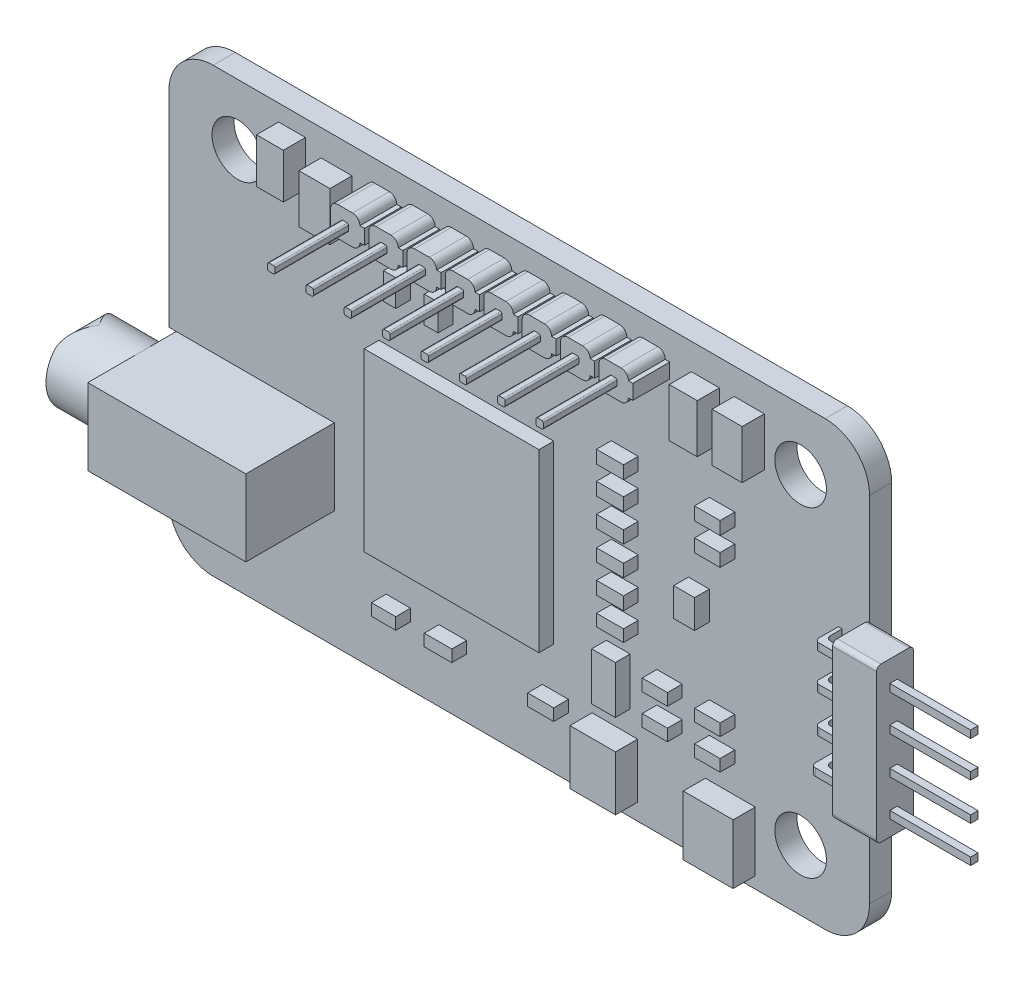
from build123d import *

# Parameters (mm, degrees)
SALIENTE_EXTRUIR1_DEPTH   = 1.5
CROQUIS3_R                = 1.75
CORTAR_EXTRUIR1_DEPTH     = 3
SIMETR_A2_COPY_1_SKETCH_R = 1.75
SIMETR_A2_COPY_1_DEPTH    = 3
CROQUIS4_W                = 11.845226559
CROQUIS4_H                = 11.924194736
SALIENTE_EXTRUIR2_DEPTH   = 1
SALIENTE_EXTRUIR3_DEPTH   = 2.5
SALIENTE_EXTRUIR4_DEPTH   = 5
MATRIZL1_COUNT            = 8
MATRIZL1_PITCH            = 2.6
CROQUIS8_W                = 1.5
CROQUIS8_H                = 5.17065222
SALIENTE_EXTRUIR6_DEPTH   = 3.5
REDONDEO1_R               = 1
SALIENTE_EXTRUIR9_DEPTH   = 2.5
CROQUIS16_W               = 5.476213479
CROQUIS16_H               = 0.902663256
CROQUIS16_H_2             = 1.097336744
CORTAR_EXTRUIR5_DEPTH     = 39.817275584
CROQUIS17_W               = 2.348739744
CROQUIS17_H               = 0.877282124
CORTAR_EXTRUIR6_DEPTH     = 39.817275584
REDONDEO3_R               = 0.3
REDONDEO4_R               = 0.3
CROQUIS18_W               = 2.038363461
CROQUIS18_H               = 3.297382371
CROQUIS18_W_2             = 1.896357523
CROQUIS18_W_3             = 2.098475258
CROQUIS18_W_4             = 1.819560696
CROQUIS18_H_2             = 3.043464634
CROQUIS18_W_5             = 3.09164171
CROQUIS18_H_3             = 3.700825875
CROQUIS18_W_6             = 3.382058764
CROQUIS18_H_4             = 4.039758247
SALIENTE_EXTRUIR10_DEPTH  = 1.5
CROQUIS19_W               = 1.829682891
CROQUIS19_H               = 0.879261735
CROQUIS19_H_2             = 0.874792716
CROQUIS19_H_3             = 0.843079531
CROQUIS19_H_4             = 0.847548549
CROQUIS19_H_5             = 0.871813372
CROQUIS19_H_6             = 0.80289883
CROQUIS19_W_2             = 1.713917879
CROQUIS19_H_7             = 0.805472984
CROQUIS19_W_3             = 1.724011275
CROQUIS19_W_4             = 1.648431473
CROQUIS19_H_8             = 0.801595689
CROQUIS19_W_5             = 1.865654223
CROQUIS19_W_6             = 1.762049253
CROQUIS19_W_7             = 1.412898183
CROQUIS19_H_9             = 1.936032047
CROQUIS19_W_8             = 1.605264572
CROQUIS19_H_10            = 3.231106767
CROQUIS19_W_9             = 0.932827111
CROQUIS19_H_11            = 1.810723855
CROQUIS19_W_10            = 0.824215736
SALIENTE_EXTRUIR11_DEPTH  = 1
SALIENTE_EXTRUIR12_DEPTH  = 6
CORTAR_EXTRUIR7_DEPTH     = 4
CROQUIS24_R               = 1.25
CORTAR_EXTRUIR8_DEPTH     = 10


with BuildPart() as part:
    # Croquis1 → Saliente-Extruir1 (new body)
    with BuildSketch(Plane.XY):
        with BuildLine():
            Line((-20.75, -15), (20.75, -15))
            ThreePointArc((20.75, -15), (22.871320344, -14.121320344), (23.75, -12))
            Line((23.75, -12), (23.75, 12))
            ThreePointArc((23.75, 12), (22.871320344, 14.121320344), (20.75, 15))
            Line((20.75, 15), (-20.75, 15))
            ThreePointArc((-20.75, 15), (-22.871320344, 14.121320344), (-23.75, 12))
            Line((-23.75, 12), (-23.75, -12))
            ThreePointArc((-23.75, -12), (-22.871320344, -14.121320344), (-20.75, -15))
        make_face()
    extrude(amount=SALIENTE_EXTRUIR1_DEPTH)

    # Croquis3 → Cortar-Extruir1 (cut)
    with BuildSketch(Plane.XY.offset(1.5)):
        with Locations((-19.079590038, -10.880716526)):
            Circle(CROQUIS3_R)
    cortar_extruir1 = extrude(amount=-CORTAR_EXTRUIR1_DEPTH, mode=Mode.SUBTRACT)

    # Simetría1: Cortar-Extruir1 across plane
    add(cortar_extruir1.mirror(Plane(origin=(0, 0, 0), x_dir=(0, 0, 1), z_dir=(0, -1, 0))), mode=Mode.SUBTRACT)

    # Simetría2: Cortar-Extruir1 across plane
    add(cortar_extruir1.mirror(Plane.ZY), mode=Mode.SUBTRACT)

    # Simetría2 copy 1 sketch → Simetría2 copy 1 (cut)
    with BuildSketch(Plane(origin=(0, 0, 1.5), x_dir=(-1, 0, 0), z_dir=(0, 0, 1))):
        with Locations((-19.079590038, -10.880716526)):
            Circle(SIMETR_A2_COPY_1_SKETCH_R)
    extrude(amount=-SIMETR_A2_COPY_1_DEPTH, mode=Mode.SUBTRACT)

    # Croquis4 → Saliente-Extruir2 (add)
    with BuildSketch(Plane.XY.offset(1.5)):
        with Locations((-3.584619941, -1.490083818)):
            Rectangle(CROQUIS4_W, CROQUIS4_H)
    extrude(amount=SALIENTE_EXTRUIR2_DEPTH)

    # Croquis5 → Saliente-Extruir3 (add)
    with BuildSketch(Plane.XY.offset(1.5)):
        with BuildLine():
            Line((-8.298239762, 13.050358244), (-7.993395188, 13.050358244))
            Line((-7.993395188, 13.050358244), (-7.993395188, 12.050358244))
            Line((-7.993395188, 12.050358244), (-8.298239762, 12.050358244))
            ThreePointArc((-8.298239762, 12.050358244), (-8.444686371, 11.696804854), (-8.798239762, 11.550358244))
            Line((-8.798239762, 11.550358244), (-9.798239762, 11.550358244))
            ThreePointArc((-9.798239762, 11.550358244), (-10.151793153, 11.696804854), (-10.298239762, 12.050358244))
            Line((-10.298239762, 12.050358244), (-10.298239762, 13.050358244))
            ThreePointArc((-10.298239762, 13.050358244), (-10.151793153, 13.403911635), (-9.798239762, 13.550358244))
            Line((-9.798239762, 13.550358244), (-8.798239762, 13.550358244))
            ThreePointArc((-8.798239762, 13.550358244), (-8.444686371, 13.403911635), (-8.298239762, 13.050358244))
        make_face()
    saliente_extruir3 = extrude(amount=SALIENTE_EXTRUIR3_DEPTH)

    # Croquis6 → Saliente-Extruir4 (add)
    with BuildSketch(Plane.XY.offset(4)):
        with BuildLine():
            Line((-9.46180614, 12.286791866), (-9.16180614, 12.286791866))
            ThreePointArc((-9.16180614, 12.286791866), (-9.091095462, 12.316081188), (-9.06180614, 12.386791866))
            Line((-9.06180614, 12.386791866), (-9.06180614, 12.686791866))
            ThreePointArc((-9.06180614, 12.686791866), (-9.091095462, 12.757502544), (-9.16180614, 12.786791866))
            Line((-9.16180614, 12.786791866), (-9.46180614, 12.786791866))
            ThreePointArc((-9.46180614, 12.786791866), (-9.532516818, 12.757502544), (-9.56180614, 12.686791866))
            Line((-9.56180614, 12.686791866), (-9.56180614, 12.386791866))
            ThreePointArc((-9.56180614, 12.386791866), (-9.532516818, 12.316081188), (-9.46180614, 12.286791866))
        make_face()
    saliente_extruir4 = extrude(amount=SALIENTE_EXTRUIR4_DEPTH)

    # MatrizL1: Saliente-Extruir3, Saliente-Extruir4 ×8
    with Locations(*[(i * MATRIZL1_PITCH, 0, 0) for i in range(1, MATRIZL1_COUNT)]):
        add(saliente_extruir3)
        add(saliente_extruir4)

    # Croquis8 → Saliente-Extruir6 (add)
    with BuildSketch(Plane.ZY.offset(23.75)):
        with Locations((0.75, -4.470080116)):
            Rectangle(CROQUIS8_W, CROQUIS8_H)
    extrude(amount=SALIENTE_EXTRUIR6_DEPTH)

    # Redondeo1
    redondeo1_edges = [part.edges().sort_by_distance(p)[0] for p in [
        (-27.25, -1.884754006, 0.75),
        (-27.25, -7.055406226, 0.75),
    ]]
    fillet(redondeo1_edges, radius=REDONDEO1_R)

    # Croquis18 → Saliente-Extruir10 (add)
    with BuildSketch(Plane.XY.offset(1.5)):
        with Locations((15.595959958, 11.566301598)):
            Rectangle(CROQUIS18_W, CROQUIS18_H)
        with Locations((12.621132356, 11.566301598)):
            Rectangle(CROQUIS18_W_2, CROQUIS18_H)
        with Locations((-12.381925786, 11.566301598)):
            Rectangle(CROQUIS18_W_3, CROQUIS18_H)
        with Locations((-15.398919361, 12.364554378)):
            Rectangle(CROQUIS18_W_4, CROQUIS18_H_2)
        with Locations((6.484163103, -12.028589475)):
            Rectangle(CROQUIS18_W_5, CROQUIS18_H_3)
        with Locations((14.312161738, -12.19805566)):
            Rectangle(CROQUIS18_W_6, CROQUIS18_H_4)
    extrude(amount=SALIENTE_EXTRUIR10_DEPTH)

    # Croquis19 → Saliente-Extruir11 (add)
    with BuildSketch(Plane.XY.offset(1.5)):
        with Locations((7.156154416, 6.008652534)):
            Rectangle(CROQUIS19_W, CROQUIS19_H)
        with Locations((7.156154416, 4.131070552)):
            Rectangle(CROQUIS19_W, CROQUIS19_H_2)
        with Locations((7.156154416, 2.206663629)):
            Rectangle(CROQUIS19_W, CROQUIS19_H_3)
        with Locations((7.156154416, 0.239900782)):
            Rectangle(CROQUIS19_W, CROQUIS19_H_4)
        with Locations((7.156154416, -1.685250978)):
            Rectangle(CROQUIS19_W, CROQUIS19_H_5)
        with Locations((7.156154416, -3.583437706)):
            Rectangle(CROQUIS19_W, CROQUIS19_H_6)
        with Locations((10.192682031, -5.837830438)):
            Rectangle(CROQUIS19_W_2, CROQUIS19_H_7)
        with Locations((10.192682031, -7.925592573)):
            Rectangle(CROQUIS19_W_2, CROQUIS19_H_6)
        with Locations((13.752713437, -7.925592573)):
            Rectangle(CROQUIS19_W_3, CROQUIS19_H_6)
        with Locations((13.752713437, -5.837830438)):
            Rectangle(CROQUIS19_W_3, CROQUIS19_H_7)
        with Locations((13.752713437, 4.131070552)):
            Rectangle(CROQUIS19_W_3, CROQUIS19_H_2)
        with Locations((13.752713437, 6.008652534)):
            Rectangle(CROQUIS19_W_3, CROQUIS19_H)
        with Locations((-8.19488475, -10.589898273)):
            Rectangle(CROQUIS19_W_4, CROQUIS19_H_8)
        with Locations((-4.504392319, -10.589898273)):
            Rectangle(CROQUIS19_W_5, CROQUIS19_H_8)
        with Locations((2.457166259, -10.589898273)):
            Rectangle(CROQUIS19_W_6, CROQUIS19_H_8)
        with Locations((12.184258707, 0.091827707)):
            Rectangle(CROQUIS19_W_7, CROQUIS19_H_9)
        with Locations((6.715127642, -7.05064733)):
            Rectangle(CROQUIS19_W_8, CROQUIS19_H_10)
        with Locations((-4.970805874, 8.810130944)):
            Rectangle(CROQUIS19_W_9, CROQUIS19_H_11)
        with Locations((-7.782776881, 8.810130944)):
            Rectangle(CROQUIS19_W_10, CROQUIS19_H_11)
    extrude(amount=SALIENTE_EXTRUIR11_DEPTH)

    # Croquis21 → Saliente-Extruir12 (add)
    with BuildSketch(Plane.XY.offset(1.5)):
        with BuildLine():
            Line((-26.25, -7.055406226), (-23.75, -7.055406226))
            Line((-23.75, -7.055406226), (-12.53055917, -7.055406226))
            Line((-12.53055917, -7.055406226), (-12.53055917, -1.884754006))
            Line((-12.53055917, -1.884754006), (-23.75, -1.884754006))
            Line((-23.75, -1.884754006), (-26.25, -1.884754006))
            ThreePointArc((-26.25, -1.884754006), (-26.957106781, -2.177647225), (-27.25, -2.884754006))
            Line((-27.25, -2.884754006), (-27.25, -6.055406226))
            ThreePointArc((-27.25, -6.055406226), (-26.957106781, -6.762513007), (-26.25, -7.055406226))
        make_face()
    extrude(amount=SALIENTE_EXTRUIR12_DEPTH)

    # Croquis23 → Cortar-Extruir7 (cut)
    with BuildSketch(Plane.ZY.offset(27.25)):
        with BuildLine():
            Line((6.33532611, -4.470080116), (7.5, -4.470080116))
            Line((7.5, -4.470080116), (7.5, -1.884754006))
            Line((7.5, -1.884754006), (3.75, -1.884754006))
            ThreePointArc((3.75, -1.884754006), (5.578101624, -2.641978492), (6.33532611, -4.470080116))
        make_face()
        with BuildLine():
            Line((7.5, -7.055406226), (7.5, -4.470080116))
            Line((7.5, -4.470080116), (6.33532611, -4.470080116))
            ThreePointArc((6.33532611, -4.470080116), (5.578101624, -6.29818174), (3.75, -7.055406226))
            Line((3.75, -7.055406226), (7.5, -7.055406226))
        make_face()
        with BuildLine():
            Line((0, -4.470080116), (1.16467389, -4.470080116))
            ThreePointArc((1.16467389, -4.470080116), (1.921898376, -2.641978492), (3.75, -1.884754006))
            Line((3.75, -1.884754006), (0, -1.884754006))
            Line((0, -1.884754006), (0, -4.470080116))
        make_face()
        with BuildLine():
            ThreePointArc((3.75, -7.055406226), (1.921898376, -6.29818174), (1.16467389, -4.470080116))
            Line((1.16467389, -4.470080116), (0, -4.470080116))
            Line((0, -4.470080116), (0, -7.055406226))
            Line((0, -7.055406226), (3.75, -7.055406226))
        make_face()
    extrude(amount=-CORTAR_EXTRUIR7_DEPTH, mode=Mode.SUBTRACT)

    # Croquis24 → Cortar-Extruir8 (cut)
    with BuildSketch(Plane.ZY.offset(27.25)):
        with Locations((3.75, -4.470080116)):
            Circle(CROQUIS24_R)
    extrude(amount=-CORTAR_EXTRUIR8_DEPTH, mode=Mode.SUBTRACT)


with BuildPart() as body_2:
    # Croquis15 → Saliente-Extruir9 (new body)
    with BuildSketch(Plane.XY.offset(1.5)):
        Polygon((23.75, 4.679686802), (26.726233263, 4.679686802), (26.726233263, 3.239988173), (32.202446742, 3.239988173), (32.202446742, 2.739988173), (26.726233263, 2.739988173), (26.726233263, 0.797388773), (32.202446742, 0.797388773), (32.202446742, 0.297388773), (26.726233263, 0.297388773), (26.726233263, -1.742532098), (32.202446742, -1.742532098), (32.202446742, -2.242532098), (26.726233263, -2.242532098), (26.726233263, -4.217588787), (32.202446742, -4.217588787), (32.202446742, -4.717588787), (26.726233263, -4.717588787), (26.726233263, -5.783629379), (23.75, -5.783629379), (23.75, -4.717588787), (21.401260256, -4.717588787), (21.401260256, -4.217588787), (23.75, -4.217588787), (23.75, -2.242532098), (21.65341154, -2.242532098), (21.65341154, -1.742532098), (23.75, -1.742532098), (23.75, 0.297388773), (21.65341154, 0.297388773), (21.65341154, 0.797388773), (23.75, 0.797388773), (23.75, 2.739988173), (21.65341154, 2.739988173), (21.65341154, 3.239988173), (23.75, 3.239988173), align=None)
    extrude(amount=SALIENTE_EXTRUIR9_DEPTH)

    # Croquis16 → Cortar-Extruir5 (cut, through all)
    with BuildSketch(Plane.XZ.offset(4.717588787)):
        with Locations((29.464340003, 3.548668372)):
            Rectangle(CROQUIS16_W, CROQUIS16_H)
        with Locations((29.464340003, 2.048668372)):
            Rectangle(CROQUIS16_W, CROQUIS16_H_2)
    extrude(amount=-CORTAR_EXTRUIR5_DEPTH, mode=Mode.SUBTRACT)

    # Croquis17 → Cortar-Extruir6 (cut, through all)
    with BuildSketch(Plane.XZ.offset(4.717588787)):
        with Locations((22.575630128, 3.561358938)):
            Rectangle(CROQUIS17_W, CROQUIS17_H)
        with BuildLine():
            Line((21.901260256, 1.5), (23.75, 1.5))
            Line((23.75, 1.5), (23.75, 2.622717876))
            Line((23.75, 2.622717876), (22.201260256, 2.622717876))
            ThreePointArc((22.201260256, 2.622717876), (21.989128222, 2.534849911), (21.901260256, 2.322717876))
            Line((21.901260256, 2.322717876), (21.901260256, 1.5))
        make_face()
    extrude(amount=-CORTAR_EXTRUIR6_DEPTH, mode=Mode.SUBTRACT)

    # Redondeo3
    redondeo3_edges = [body_2.edges().sort_by_distance(p)[0] for p in [
        (21.65341154, 2.989988173, 3.122717876),
        (21.65341154, 0.547388773, 3.122717876),
        (21.65341154, -1.992532098, 3.122717876),
        (21.401260256, -4.467588787, 3.122717876),
    ]]
    fillet(redondeo3_edges, radius=REDONDEO3_R)

    # Redondeo4
    redondeo4_edges = [body_2.edges().sort_by_distance(p)[0] for p in [
        (25.238116632, 4.679686802, 4),
        (25.238116632, 4.679686802, 1.5),
        (25.238116632, -5.783629379, 1.5),
        (25.238116632, -5.783629379, 4),
    ]]
    fillet(redondeo4_edges, radius=REDONDEO4_R)


solid = Compound([part.part, body_2.part])
